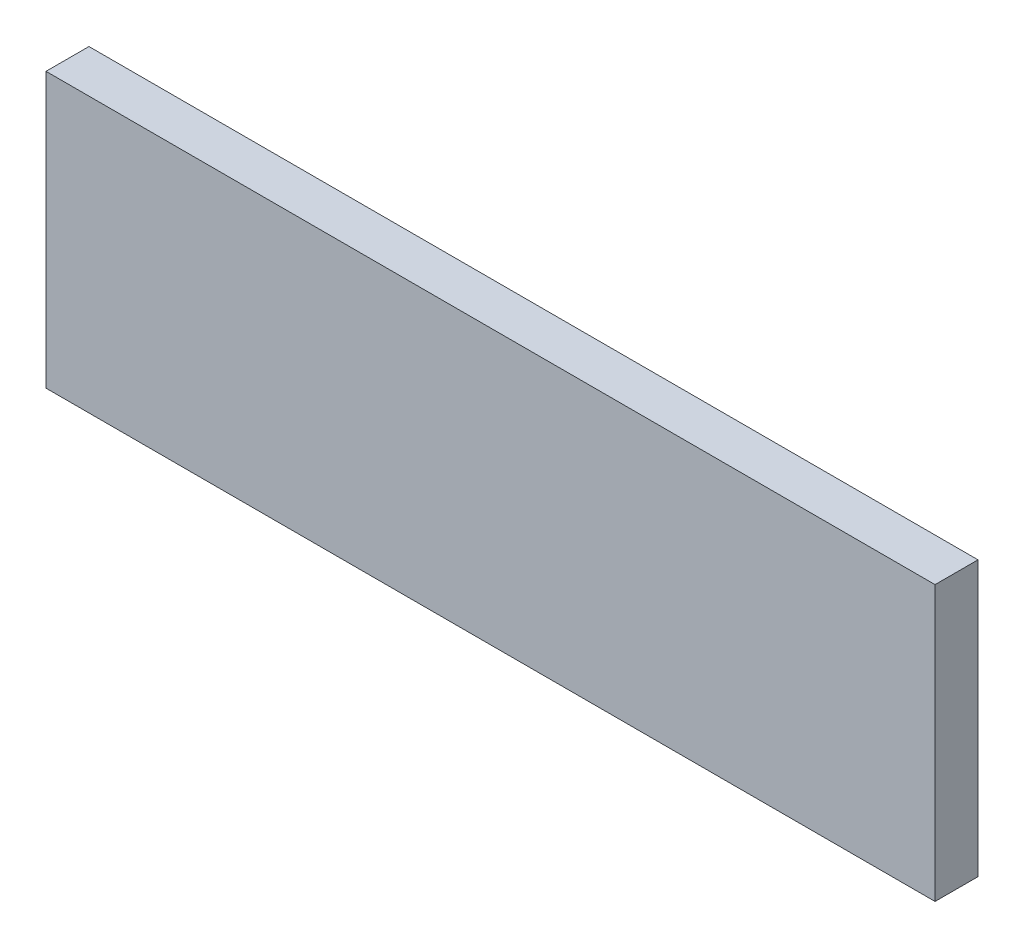
from build123d import *

# Parameters (mm, degrees)
CROQUIS1_W              = 372.58
CROQUIS1_H              = 115
SALIENTE_EXTRUIR1_DEPTH = 18


with BuildPart() as part:
    # Croquis1 → Saliente-Extruir1 (new body)
    with BuildSketch(Plane.XY):
        with Locations((101.29, 0)):
            Rectangle(CROQUIS1_W, CROQUIS1_H)
    extrude(amount=SALIENTE_EXTRUIR1_DEPTH)


solid = part.part
